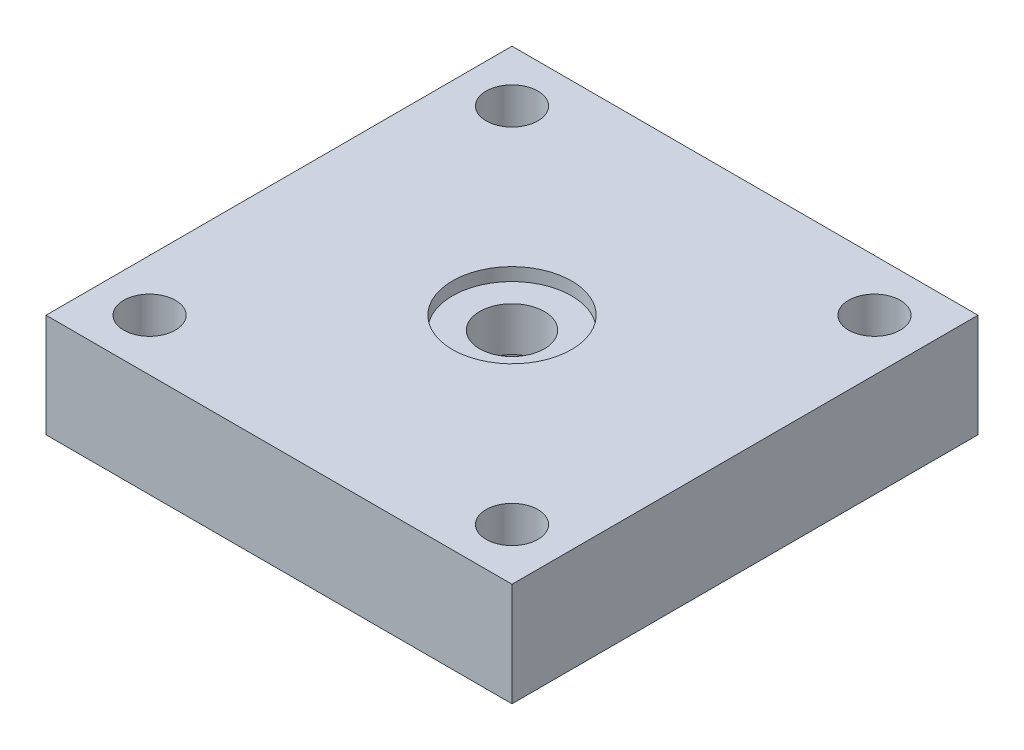
from build123d import *

# Parameters (mm, degrees)
SKETCH1_W           = 180
SKETCH1_H           = 180
SKETCH1_R           = 10
BOSS_EXTRUDE1_DEPTH = 40
SKETCH2_R           = 23
CUT_EXTRUDE1_DEPTH  = 5
SKETCH3_R           = 25
CUT_EXTRUDE2_DEPTH  = 18
SKETCH4_R           = 12.5
CUT_EXTRUDE3_DEPTH  = 18


with BuildPart() as part:
    # Sketch1 → Boss-Extrude1 (new body)
    with BuildSketch(Plane(origin=(0, 0, 0), x_dir=(1, 0, 0), z_dir=(0, 1, 0))):
        Rectangle(SKETCH1_W, SKETCH1_H)
        with Locations(Location((-70, 70, 0), (0, 0, 270))):
            Circle(SKETCH1_R, mode=Mode.SUBTRACT)
        with Locations(Location((70, 70, 0), (0, 0, 270))):
            Circle(SKETCH1_R, mode=Mode.SUBTRACT)
        with Locations(Location((-70, -70, 0), (0, 0, 270))):
            Circle(SKETCH1_R, mode=Mode.SUBTRACT)
        with Locations(Location((70, -70, 0), (0, 0, 270))):
            Circle(SKETCH1_R, mode=Mode.SUBTRACT)
    extrude(amount=BOSS_EXTRUDE1_DEPTH)

    # Sketch2 → Cut-Extrude1 (cut)
    with BuildSketch(Plane(origin=(0, 40, 0), x_dir=(1, 0, 0), z_dir=(0, 1, 0))):
        with Locations(Location((0, 0, 0), (0, 0, 270))):
            Circle(SKETCH2_R)
    extrude(amount=-CUT_EXTRUDE1_DEPTH, mode=Mode.SUBTRACT)

    # Sketch3 → Cut-Extrude2 (cut)
    with BuildSketch(Plane.XZ):
        with Locations(Location((0, 0, 0), (0, 0, 270))):
            Circle(SKETCH3_R)
    extrude(amount=-CUT_EXTRUDE2_DEPTH, mode=Mode.SUBTRACT)

    # Sketch4 → Cut-Extrude3 (cut)
    with BuildSketch(Plane.XZ.offset(-18)):
        with Locations(Location((0, 0, 0), (0, 0, 270))):
            Circle(SKETCH4_R)
    extrude(amount=-CUT_EXTRUDE3_DEPTH, mode=Mode.SUBTRACT)


solid = part.part
